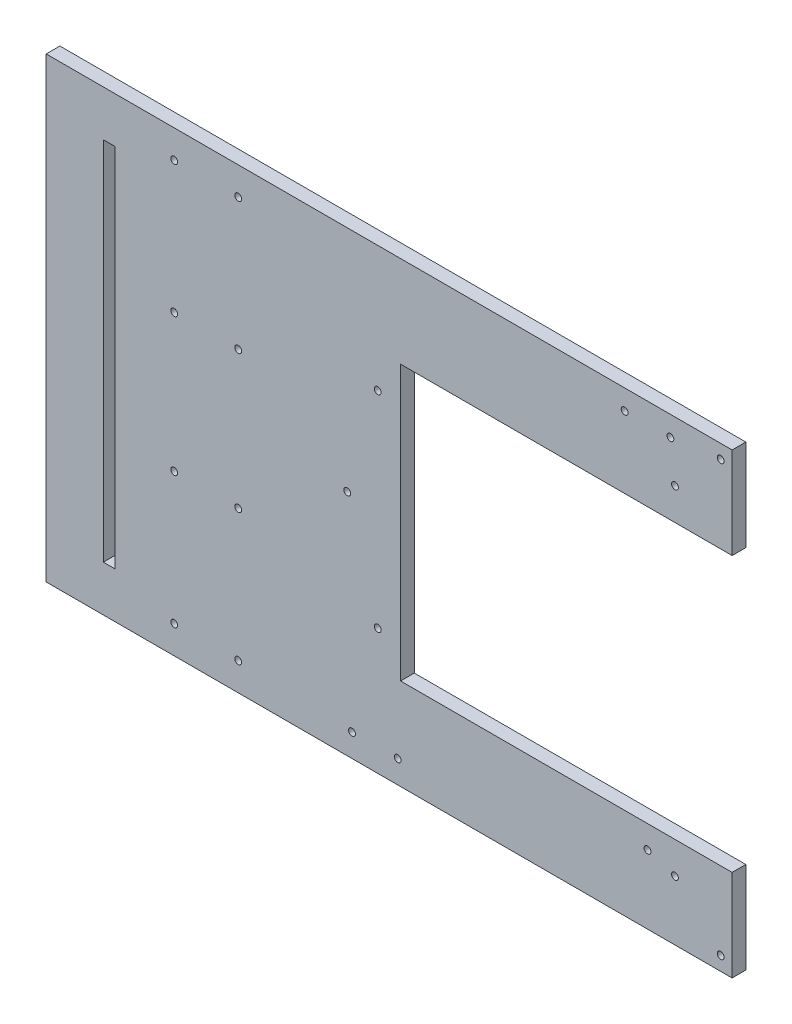
from build123d import *

# Parameters (mm, degrees)
SKETCH1_W                       = 300
SKETCH1_H                       = 200
BOSS_EXTRUDE1_DEPTH             = 6
SKETCH2_W                       = 145
SKETCH2_H                       = 120
CUT_EXTRUDE1_DEPTH              = 6
SKETCH3_W                       = 5
SKETCH3_H                       = 160
CUT_EXTRUDE2_DEPTH              = 6
F_3_0MM_PRESS_DOWEL_HOLE1_D     = 3
F_3_0MM_PRESS_DOWEL_HOLE1_DEPTH = 6
F_3_0MM_PRESS_DOWEL_HOLE1_TIP   = 0.901290929


with BuildPart() as part:
    # Sketch1 → Boss-Extrude1 (new body)
    with BuildSketch(Plane.XY):
        with Locations((150, 100)):
            Rectangle(SKETCH1_W, SKETCH1_H)
    extrude(amount=BOSS_EXTRUDE1_DEPTH)

    # Sketch2 → Cut-Extrude1 (cut)
    with BuildSketch(Plane.XY):
        with Locations((227.5, 100)):
            Rectangle(SKETCH2_W, SKETCH2_H)
    extrude(amount=CUT_EXTRUDE1_DEPTH, mode=Mode.SUBTRACT)

    # Sketch3 → Cut-Extrude2 (cut)
    with BuildSketch(Plane.XY):
        with Locations((27.5, 100)):
            Rectangle(SKETCH3_W, SKETCH3_H)
    extrude(amount=CUT_EXTRUDE2_DEPTH, mode=Mode.SUBTRACT)

    # Ø3.0mm Press Dowel Hole1
    with Locations(Plane(origin=(42.474486637, -126.531359221, 6), x_dir=(1, 0, 0), z_dir=(0, 0, 1))):
        with Locations((220.525513363, 156.531359221), (102.525513363, 181.531359221), (102.525513363, 271.531359221), (89.19270005, 226.531359221), (210.525513363, 317.793651488), (230.525513363, 317.793651488), (252.525513363, 320.462332131), (232.525513363, 300.462332131), (252.525513363, 132.600386311), (232.525513363, 152.600386311), (111.286271896, 136.531359221), (91.286271896, 136.531359221), (41.525513363, 196.432813402), (13.525513363, 196.432813402), (41.525513363, 138.767959221), (13.525513363, 138.767959221), (41.525513363, 256.62990504), (13.525513363, 256.62990504), (41.525513363, 314.294759221), (13.525513363, 314.294759221)):
            Hole(F_3_0MM_PRESS_DOWEL_HOLE1_D / 2, depth=F_3_0MM_PRESS_DOWEL_HOLE1_DEPTH)
            with Locations((0, 0, -(F_3_0MM_PRESS_DOWEL_HOLE1_DEPTH + F_3_0MM_PRESS_DOWEL_HOLE1_TIP / 2))):  # 118° drill point
                Cone(0, F_3_0MM_PRESS_DOWEL_HOLE1_D / 2, F_3_0MM_PRESS_DOWEL_HOLE1_TIP, mode=Mode.SUBTRACT)


solid = part.part
